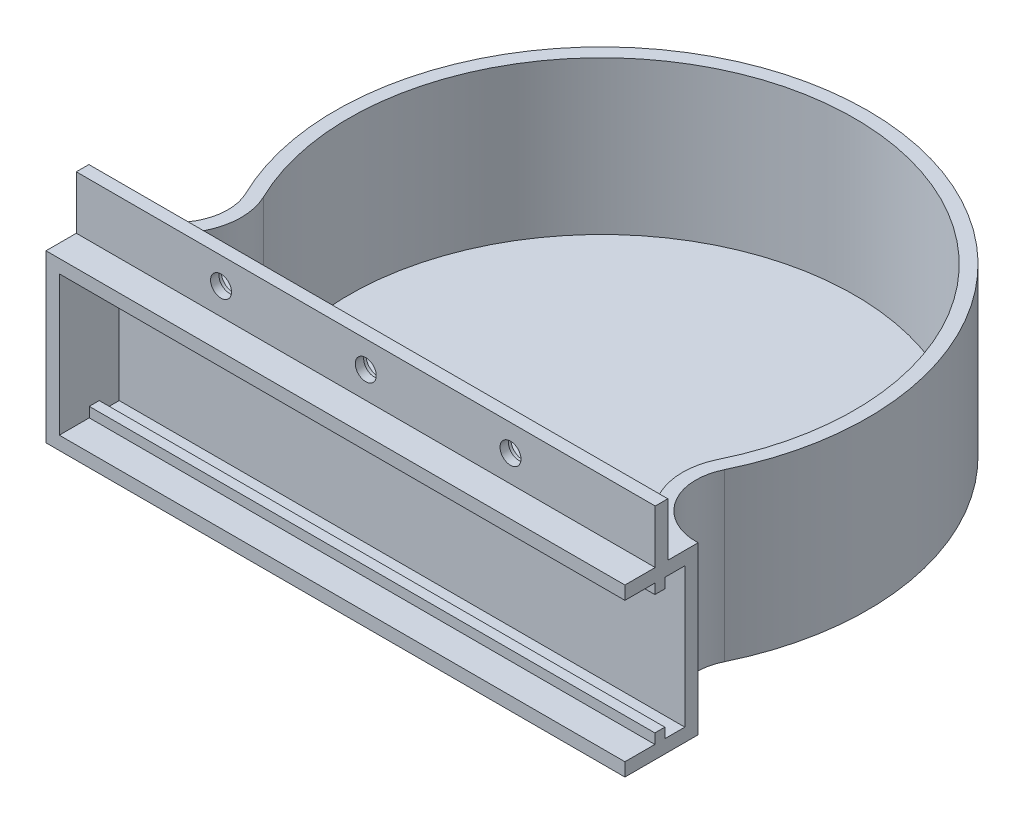
from build123d import *

# Parameters (mm, degrees)
SKETCH1_W           = 138.1125
SKETCH1_H           = 39.6875
SKETCH1_W_2         = 131.7625
SKETCH1_H_2         = 33.3375
BOSS_EXTRUDE1_DEPTH = 14.2875
SKETCH2_W           = 138.1125
SKETCH2_H           = 39.6875
BOSS_EXTRUDE2_DEPTH = 3.175
CUT_EXTRUDE1_REACH  = 142.26
SKETCH3_W           = 14.2875
SKETCH3_H           = 33.3375
BOSS_EXTRUDE3_REACH = 142.26
SKETCH4_W           = 2.38125
SKETCH4_H           = 2.38125
BOSS_EXTRUDE4_START = -8.73125
SKETCH6_W           = 138.1125
SKETCH6_H           = 12.7
SKETCH6_R           = 2.5
BOSS_EXTRUDE4_DEPTH = 1.5
SKETCH7_R           = 2.95
CUT_EXTRUDE2_DEPTH  = 1
SKETCH8_R           = 63.5
BOSS_EXTRUDE5_DEPTH = 3.175
FILLET1_R           = 12.7
BOSS_EXTRUDE6_DEPTH = 36.5125


with BuildPart() as part:
    # Sketch1 → Boss-Extrude1 (new body)
    with BuildSketch(Plane.XY):
        Rectangle(SKETCH1_W, SKETCH1_H)
        Rectangle(SKETCH1_W_2, SKETCH1_H_2, mode=Mode.SUBTRACT)
    extrude(amount=BOSS_EXTRUDE1_DEPTH)

    # Sketch2 → Boss-Extrude2 (add)
    with BuildSketch(Plane(origin=(0, 0, 0), x_dir=(-1, 0, 0), z_dir=(0, 0, -1))):
        Rectangle(SKETCH2_W, SKETCH2_H)
    extrude(amount=BOSS_EXTRUDE2_DEPTH)

    # Sketch3 → Cut-Extrude1 (cut, up to next)
    with BuildSketch(Plane(origin=(69.05625, 0, 0), x_dir=(0, 0, -1), z_dir=(1, 0, 0)), mode=Mode.PRIVATE) as cut_extrude1_sk1:
        with Locations((-7.14375, 0)):
            Rectangle(SKETCH3_W, SKETCH3_H)
    cut_extrude1_tool1 = extrude(cut_extrude1_sk1.sketch, amount=-CUT_EXTRUDE1_REACH, mode=Mode.PRIVATE) & part.part
    add(cut_extrude1_tool1.solids().sort_by_distance((69.05625, 0, 7.14375))[0], mode=Mode.SUBTRACT)

    # Sketch4 → Boss-Extrude3 (add, up to next)
    with BuildSketch(Plane(origin=(69.05625, 0, 0), x_dir=(0, 0, -1), z_dir=(1, 0, 0)), mode=Mode.PRIVATE) as boss_extrude3_sk1:
        with Locations((-5.953125, -15.478125)):
            Rectangle(SKETCH4_W, SKETCH4_H)
    boss_extrude3_tool1 = extrude(boss_extrude3_sk1.sketch, amount=-BOSS_EXTRUDE3_REACH, mode=Mode.PRIVATE) - part.part
    # Sketch4 → Boss-Extrude3 (add, up to next)
    with BuildSketch(Plane(origin=(69.05625, 0, 0), x_dir=(0, 0, -1), z_dir=(1, 0, 0)), mode=Mode.PRIVATE) as boss_extrude3_sk2:
        with Locations((-5.953125, 15.478125)):
            Rectangle(SKETCH4_W, SKETCH4_H)
    boss_extrude3_tool2 = extrude(boss_extrude3_sk2.sketch, amount=-BOSS_EXTRUDE3_REACH, mode=Mode.PRIVATE) - part.part
    add(boss_extrude3_tool1.solids().sort_by_distance((69.05625, -15.478125, 5.953125))[0])
    add(boss_extrude3_tool2.solids().sort_by_distance((69.05625, 15.478125, 5.953125))[0])

    # Sketch6 → Boss-Extrude4 (add, symmetric)
    with BuildSketch(Plane(origin=(0, 0, -3.175), x_dir=(-1, 0, 0), z_dir=(0, 0, -1)).offset(BOSS_EXTRUDE4_START)):
        with Locations((0, 26.19375)):
            Rectangle(SKETCH6_W, SKETCH6_H)
        with Locations((0, 26.19375)):
            Circle(SKETCH6_R, mode=Mode.SUBTRACT)
        with Locations((-34.528125, 26.19375)):
            Circle(SKETCH6_R, mode=Mode.SUBTRACT)
        with Locations((34.528125, 26.19375)):
            Circle(SKETCH6_R, mode=Mode.SUBTRACT)
    extrude(amount=BOSS_EXTRUDE4_DEPTH, both=True)

    # Sketch7 → Cut-Extrude2 (cut)
    with BuildSketch(Plane(origin=(0, 0, 4.05625), x_dir=(-1, 0, 0), z_dir=(0, 0, -1))):
        with Locations((-34.528125, 26.19375)):
            Circle(SKETCH7_R)
        with Locations((0, 26.19375)):
            Circle(SKETCH7_R)
        with Locations((34.528125, 26.19375)):
            Circle(SKETCH7_R)
    extrude(amount=-CUT_EXTRUDE2_DEPTH, mode=Mode.SUBTRACT)

    # Sketch8 → Boss-Extrude5 (add)
    with BuildSketch(Plane.XZ.offset(19.84375)):
        with Locations((0, -49.2125)):
            Circle(SKETCH8_R)
    extrude(amount=-BOSS_EXTRUDE5_DEPTH)

    # Fillet1
    fillet1_edges = [part.edges().sort_by_distance(p)[0] for p in [
        (-43.735552972, -18.25625, -3.175),
        (43.735552972, -18.25625, -3.175),
    ]]
    fillet(fillet1_edges, radius=FILLET1_R)

    # Sketch10 → Boss-Extrude6 (add)
    with BuildSketch(Plane(origin=(0, -16.66875, 0), x_dir=(1, 0, 0), z_dir=(0, 1, 0))):
        with BuildLine():
            Line((-68.520442889, 3.175), (-58.995442889, 3.175))
            ThreePointArc((-58.995442889, 3.175), (-53.090093775, 12.144054919), (-54.245350621, 22.8203125))
            ThreePointArc((-54.245350621, 22.8203125), (0, 109.5375), (54.245350621, 22.8203125))
            ThreePointArc((54.245350621, 22.8203125), (53.090093775, 12.144054919), (58.995442889, 3.175))
            Line((58.995442889, 3.175), (68.520442889, 3.175))
            ThreePointArc((68.520442889, 3.175), (57.753494041, 9.139807909), (57.100369074, 21.43125))
            ThreePointArc((57.100369074, 21.43125), (0, 112.7125), (-57.100369074, 21.43125))
            ThreePointArc((-57.100369074, 21.43125), (-57.753494041, 9.139807909), (-68.520442889, 3.175))
        make_face()
    extrude(amount=BOSS_EXTRUDE6_DEPTH)


solid = part.part
